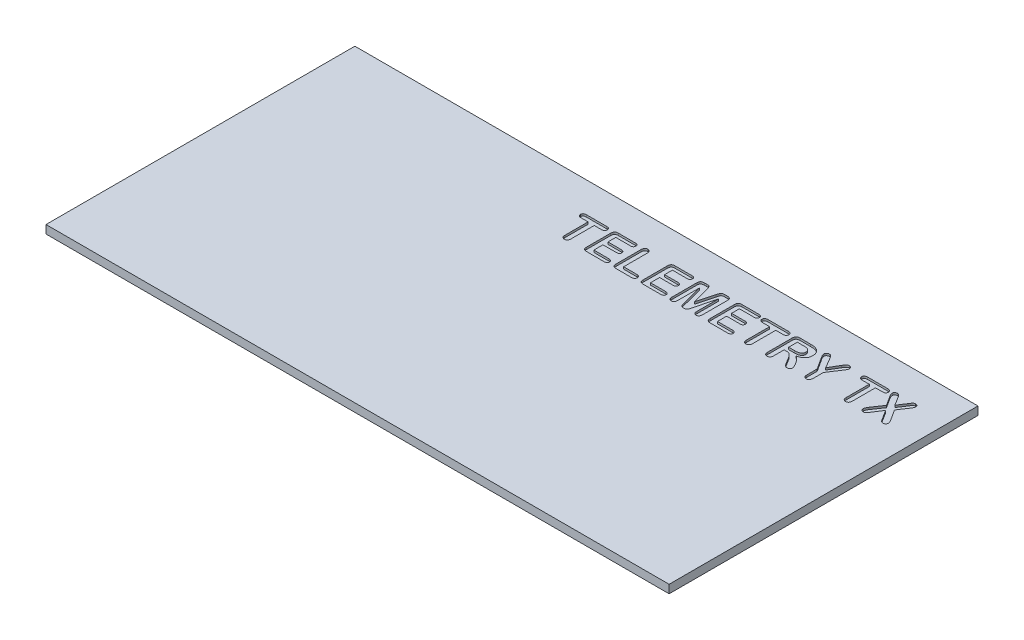
from build123d import *

# Parameters (mm, degrees)
SKETCH1_W           = 150.7
SKETCH1_H           = 74.7
BOSS_EXTRUDE1_DEPTH = 2
CUT_EXTRUDE1_DEPTH  = 0.5


with BuildPart() as part:
    # Sketch1 → Boss-Extrude1 (new body)
    with BuildSketch(Plane(origin=(0, 0, 0), x_dir=(1, 0, 0), z_dir=(0, 1, 0))):
        Rectangle(SKETCH1_W, SKETCH1_H)
    extrude(amount=BOSS_EXTRUDE1_DEPTH)

    # Sketch2 → Cut-Extrude1 (cut)
    # profile 1 of 11: a face of its own
    with BuildSketch(Plane(origin=(0, 2, 0), x_dir=(1, 0, 0), z_dir=(0, 1, 0))):
        with BuildLine():
            Line((62.4328125, 23.884375), (64.15625, 26.4078125))
            Line((64.15625, 26.4078125), (62.70625, 28.659375))
            add(Edge.make_bspline(
                [(62.70625, 28.659375), (62.674291718, 28.711863437), (62.612971243, 28.812576483), (62.528319317, 28.958293651), (62.457920035, 29.093522992), (62.397925139, 29.217591875), (62.354171528, 29.336643603), (62.320110418, 29.450542498), (62.300705678, 29.562873745), (62.298140505, 29.636911591), (62.296875, 29.6734375)],
                knots=[0, 0, 0, 0, 1.331670414, 2.555164369, 3.650619108, 4.635170215, 5.538697084, 6.395999096, 7.20868049, 8, 8, 8, 8], degree=3))
            add(Edge.make_bspline(
                [(62.296875, 29.6734375), (62.299255859, 29.709717184), (62.304043831, 29.782676618), (62.344369849, 29.887563571), (62.406673864, 29.986545995), (62.493008175, 30.075673841), (62.595350729, 30.15271172), (62.711968289, 30.210935045), (62.840389761, 30.243924012), (62.929503853, 30.247946412), (62.975, 30.25)],
                knots=[0, 0, 0, 0, 0.88371339, 1.777171737, 2.709025234, 3.725927513, 4.789507843, 5.82502123, 6.889590265, 8, 8, 8, 8], degree=3))
            add(Edge.make_bspline(
                [(62.975, 30.25), (63.026259004, 30.247681497), (63.124430739, 30.243241078), (63.263206316, 30.207340641), (63.383885276, 30.145194115), (63.489687051, 30.05346807), (63.591515437, 29.928843965), (63.706024038, 29.768175786), (63.84087511, 29.568134374), (63.932893562, 29.41861339), (63.9828125, 29.3375)],
                knots=[0, 0, 0, 0, 0.856633498, 1.640632697, 2.377108086, 3.106645696, 3.965624018, 5.063496707, 6.406981199, 8, 8, 8, 8], degree=3))
            Line((63.9828125, 29.3375), (65.1390625, 27.45))
            Line((65.1390625, 27.45), (66.3734375, 29.3375))
            add(Edge.make_bspline(
                [(66.3734375, 29.3375), (66.421110003, 29.411286135), (66.508542286, 29.546611322), (66.626273301, 29.737259468), (66.731553929, 29.895517955), (66.834410195, 30.024700096), (66.941048032, 30.127670801), (67.063451732, 30.199063945), (67.201712911, 30.243117297), (67.300172503, 30.247639619), (67.3515625, 30.25)],
                knots=[0, 0, 0, 0, 1.496623949, 2.744837013, 3.817943476, 4.732634022, 5.555221563, 6.326834216, 7.126707895, 8, 8, 8, 8], degree=3))
            add(Edge.make_bspline(
                [(67.3515625, 30.25), (67.398633776, 30.248053962), (67.489338031, 30.244304033), (67.618819131, 30.211121497), (67.733984838, 30.153476409), (67.832675339, 30.074933491), (67.916088277, 29.984625782), (67.97503318, 29.88138503), (68.013545353, 29.770403431), (68.017002402, 29.692504333), (68.01875, 29.653125)],
                knots=[0, 0, 0, 0, 1.132100252, 2.181506828, 3.191039156, 4.209567341, 5.204189317, 6.131291943, 7.055335938, 8, 8, 8, 8], degree=3))
            add(Edge.make_bspline(
                [(68.01875, 29.653125), (68.017401098, 29.622316647), (68.014544465, 29.557072374), (67.994499233, 29.456077471), (67.963232862, 29.347094124), (67.916019714, 29.23174796), (67.860785273, 29.106122723), (67.789493596, 28.974620949), (67.708029625, 28.833884538), (67.646320196, 28.739804142), (67.6140625, 28.690625)],
                knots=[0, 0, 0, 0, 0.699379586, 1.481108469, 2.330742825, 3.27072707, 4.308249908, 5.445709565, 6.664782263, 8, 8, 8, 8], degree=3))
            Line((67.6140625, 28.690625), (66.0953125, 26.4078125))
            Line((66.0953125, 26.4078125), (67.7296875, 23.884375))
            add(Edge.make_bspline(
                [(67.7296875, 23.884375), (67.764436344, 23.831487411), (67.830235215, 23.731341816), (67.917495818, 23.586279323), (67.990363374, 23.455680869), (68.049385912, 23.337801278), (68.09472621, 23.227856179), (68.126425867, 23.122226004), (68.146042385, 23.019481872), (68.148707783, 22.95164038), (68.15, 22.91875)],
                knots=[0, 0, 0, 0, 1.42267206, 2.693908744, 3.805137528, 4.784457108, 5.656448903, 6.47523723, 7.260776463, 8, 8, 8, 8], degree=3))
            add(Edge.make_bspline(
                [(68.15, 22.91875), (68.14857157, 22.88848563), (68.145769651, 22.829120903), (68.130322624, 22.741582905), (68.101839934, 22.658606527), (68.062508113, 22.580646776), (68.014433749, 22.507513416), (67.953602736, 22.444199175), (67.886757248, 22.384577608), (67.808199307, 22.33747742), (67.724070934, 22.298102692), (67.634387254, 22.269437693), (67.539057889, 22.254189801), (67.474008142, 22.251420955), (67.440625, 22.25)],
                knots=[0, 0, 0, 0, 1.000825385, 1.963157486, 2.926720584, 3.889052685, 4.843965475, 5.806297575, 6.782844197, 7.795590722, 8.81997505, 9.848977645, 10.89610818, 12, 12, 12, 12], degree=3))
            add(Edge.make_bspline(
                [(67.440625, 22.25), (67.405123478, 22.251191804), (67.336804147, 22.253485317), (67.238704116, 22.271246166), (67.148182733, 22.298684468), (67.042201574, 22.35303627), (66.926137837, 22.439460245), (66.831267765, 22.55315699), (66.75489531, 22.666805023), (66.679974261, 22.785768081), (66.579520052, 22.934101692), (66.50807141, 23.045140394), (66.46875, 23.10625)],
                knots=[0, 0, 0, 0, 0.778086853, 1.497354761, 2.180142313, 2.844233073, 4.100730988, 5.323601136, 6.071330611, 7.104249183, 8.406337728, 10, 10, 10, 10], degree=3))
            Line((66.46875, 23.10625), (65.1125, 25.25))
            Line((65.1125, 25.25), (63.6734375, 23.0421875))
            add(Edge.make_bspline(
                [(63.6734375, 23.0421875), (63.647278334, 23.001638882), (63.599031251, 22.92685238), (63.534496189, 22.823199594), (63.479014295, 22.741596753), (63.42548201, 22.655813472), (63.355131311, 22.565823507), (63.266400374, 22.462098723), (63.156018707, 22.371886426), (63.025722217, 22.302014887), (62.873272714, 22.256139253), (62.763896345, 22.252118906), (62.70625, 22.25)],
                knots=[0, 0, 0, 0, 1.094934508, 2.019460233, 2.770064858, 3.3338705, 4.312410748, 5.358619171, 6.425449731, 7.525220658, 8.695678178, 10, 10, 10, 10], degree=3))
            add(Edge.make_bspline(
                [(62.70625, 22.25), (62.660705497, 22.251896071), (62.572506116, 22.255567915), (62.447054887, 22.2898045), (62.332803625, 22.343541325), (62.232787717, 22.420278154), (62.149124368, 22.518453379), (62.091926177, 22.639221738), (62.054315263, 22.777964521), (62.051489207, 22.877327564), (62.05, 22.9296875)],
                knots=[0, 0, 0, 0, 1.022127674, 1.979405277, 2.901287438, 3.845220278, 4.792850708, 5.772222242, 6.8260595, 8, 8, 8, 8], degree=3))
            add(Edge.make_bspline(
                [(62.05, 22.9296875), (62.051427327, 22.963078404), (62.054387913, 23.032338345), (62.072130398, 23.138716415), (62.102565129, 23.250445277), (62.144830832, 23.367521135), (62.200274472, 23.489142879), (62.266252733, 23.616540623), (62.344748436, 23.749043805), (62.402788052, 23.838235358), (62.4328125, 23.884375)],
                knots=[0, 0, 0, 0, 0.768817885, 1.594694242, 2.475893687, 3.431591364, 4.45659618, 5.550524954, 6.732863178, 8, 8, 8, 8], degree=3))
        make_face()
    # profile 2 of 11: a face of its own
    with BuildSketch(Plane(origin=(0, 2, 0), x_dir=(1, 0, 0), z_dir=(0, 1, 0))):
        with BuildLine():
            Line((60.8578125, 28.75), (59.15, 28.75))
            Line((59.15, 28.75), (59.15, 23.19375))
            add(Edge.make_bspline(
                [(59.15, 23.19375), (59.148148683, 23.118535681), (59.144686184, 22.97786313), (59.105288163, 22.781404942), (59.041477772, 22.614492132), (58.948549707, 22.479737946), (58.835904267, 22.375968674), (58.705825861, 22.302721538), (58.56031622, 22.256840006), (58.457641248, 22.252327359), (58.4046875, 22.25)],
                knots=[0, 0, 0, 0, 1.324771526, 2.4777063, 3.516495944, 4.454151167, 5.338361256, 6.19400724, 7.068574513, 8, 8, 8, 8], degree=3))
            add(Edge.make_bspline(
                [(58.4046875, 22.25), (58.351142683, 22.252124623), (58.24715597, 22.256250747), (58.100563979, 22.305181765), (57.966914435, 22.376697952), (57.853295254, 22.483117179), (57.758625993, 22.617658023), (57.696912448, 22.785554926), (57.654827435, 22.97968454), (57.651673905, 23.119523156), (57.65, 23.19375)],
                knots=[0, 0, 0, 0, 0.936591527, 1.818907611, 2.686883908, 3.580272073, 4.52668274, 5.549195867, 6.699104295, 8, 8, 8, 8], degree=3))
            Line((57.65, 23.19375), (57.65, 28.75))
            Line((57.65, 28.75), (55.940625, 28.75))
            add(Edge.make_bspline(
                [(55.940625, 28.75), (55.877905618, 28.751556279), (55.760231213, 28.754476178), (55.596906818, 28.789852284), (55.456740423, 28.842988626), (55.343325711, 28.922921396), (55.256539538, 29.021221203), (55.19315205, 29.133869266), (55.157079634, 29.261375609), (55.152406376, 29.350818595), (55.15, 29.396875)],
                knots=[0, 0, 0, 0, 1.298175259, 2.435642608, 3.448405227, 4.386245553, 5.281324188, 6.14672195, 7.045701294, 8, 8, 8, 8], degree=3))
            add(Edge.make_bspline(
                [(55.15, 29.396875), (55.152003331, 29.445113421), (55.155866362, 29.538131793), (55.19667311, 29.668486726), (55.260181417, 29.783764012), (55.351502619, 29.879883878), (55.466220724, 29.95798555), (55.605087679, 30.011772948), (55.765644078, 30.044805548), (55.880029663, 30.048201178), (55.940625, 30.05)],
                knots=[0, 0, 0, 0, 0.993926626, 1.916593339, 2.793690024, 3.692250099, 4.629614642, 5.63892321, 6.749228366, 8, 8, 8, 8], degree=3))
            Line((55.940625, 30.05), (60.8578125, 30.05))
            add(Edge.make_bspline(
                [(60.8578125, 30.05), (60.921559191, 30.048386745), (61.04126913, 30.045357212), (61.207509792, 30.01065929), (61.349519021, 29.955899164), (61.462318061, 29.873323553), (61.552113655, 29.77610947), (61.613727111, 29.661365636), (61.653058231, 29.533799084), (61.657222549, 29.443532148), (61.659375, 29.396875)],
                knots=[0, 0, 0, 0, 1.304496451, 2.449714448, 3.464685333, 4.39788137, 5.28974218, 6.154486031, 7.046091257, 8, 8, 8, 8], degree=3))
            add(Edge.make_bspline(
                [(61.659375, 29.396875), (61.657109889, 29.350784207), (61.652703748, 29.261127431), (61.614520318, 29.133710702), (61.549633141, 29.021124348), (61.461248062, 28.922855601), (61.346290994, 28.842994176), (61.204147791, 28.789615927), (61.039182525, 28.754757885), (60.920516423, 28.751644914), (60.8578125, 28.75)],
                knots=[0, 0, 0, 0, 0.94771637, 1.843517728, 2.708217129, 3.604275273, 4.544436114, 5.560171289, 6.710778986, 8, 8, 8, 8], degree=3))
        make_face()
    # profile 3 of 11: a face of its own
    with BuildSketch(Plane(origin=(0, 2, 0), x_dir=(1, 0, 0), z_dir=(0, 1, 0))):
        with BuildLine():
            Line((48.15, 23.2046875), (48.15, 25.659375))
            Line((48.15, 25.659375), (46.2609375, 28.5875))
            add(Edge.make_bspline(
                [(46.2609375, 28.5875), (46.222833372, 28.649946443), (46.151649635, 28.766604965), (46.053280373, 28.930600113), (45.975574037, 29.074468671), (45.912489161, 29.198248655), (45.865004183, 29.307990618), (45.834532149, 29.408875621), (45.811389342, 29.501566338), (45.808967973, 29.561855242), (45.8078125, 29.590625)],
                knots=[0, 0, 0, 0, 1.578704085, 2.94923576, 4.126117189, 5.106279063, 5.947518741, 6.701154241, 7.3801931, 8, 8, 8, 8], degree=3))
            add(Edge.make_bspline(
                [(45.8078125, 29.590625), (45.80996706, 29.634178898), (45.814213448, 29.720018557), (45.85595359, 29.843692969), (45.922435739, 29.957438135), (46.013983872, 30.058508559), (46.123201055, 30.144281846), (46.248850094, 30.205885586), (46.386437584, 30.243070011), (46.482054922, 30.247645773), (46.53125, 30.25)],
                knots=[0, 0, 0, 0, 0.958325345, 1.888747574, 2.846728284, 3.847924353, 4.880105609, 5.892649082, 6.915768894, 8, 8, 8, 8], degree=3))
            add(Edge.make_bspline(
                [(46.53125, 30.25), (46.581483277, 30.248291181), (46.677032858, 30.245040806), (46.811177221, 30.210032829), (46.927239864, 30.152324779), (47.006356289, 30.080557509), (47.064033949, 30.010725877), (47.113749633, 29.947289082), (47.168019192, 29.871578987), (47.229344787, 29.786610322), (47.293181459, 29.688321885), (47.363385604, 29.579730202), (47.438534825, 29.458648233), (47.490164635, 29.373994811), (47.5171875, 29.3296875)],
                knots=[0, 0, 0, 0, 1.265501549, 2.407132258, 3.471422434, 4.505396917, 5.074392452, 5.758183804, 6.539210356, 7.425661256, 8.402912227, 9.49699419, 10.68993536, 12, 12, 12, 12], degree=3))
            Line((47.5171875, 29.3296875), (48.928125, 26.95))
            Line((48.928125, 26.95), (50.35625, 29.3296875))
            add(Edge.make_bspline(
                [(50.35625, 29.3296875), (50.396912009, 29.397373632), (50.47078452, 29.520342089), (50.573827592, 29.693031251), (50.669699951, 29.844263251), (50.770501024, 29.980292855), (50.884080481, 30.096404558), (51.014016573, 30.1861902), (51.167514131, 30.242632806), (51.278645238, 30.247449232), (51.3375, 30.25)],
                knots=[0, 0, 0, 0, 1.334293152, 2.4240707, 3.398137561, 4.359235497, 5.280289657, 6.12976972, 7.009530634, 8, 8, 8, 8], degree=3))
            add(Edge.make_bspline(
                [(51.3375, 30.25), (51.385147839, 30.247690637), (51.477216734, 30.243228303), (51.609203241, 30.205862054), (51.728281211, 30.144066601), (51.831592809, 30.059060871), (51.919387598, 29.961494951), (51.980791488, 29.851128427), (52.021556328, 29.73406268), (52.025911656, 29.652425088), (52.028125, 29.6109375)],
                knots=[0, 0, 0, 0, 1.094596951, 2.115066153, 3.127980142, 4.159086809, 5.178077631, 6.127785484, 7.048555174, 8, 8, 8, 8], degree=3))
            add(Edge.make_bspline(
                [(52.028125, 29.6109375), (52.026947726, 29.576472008), (52.024593583, 29.50755285), (52.004473463, 29.404338205), (51.973345606, 29.301088132), (51.927554279, 29.194614059), (51.865026931, 29.079598518), (51.788287119, 28.946838433), (51.694861624, 28.793608536), (51.623836825, 28.686722584), (51.5859375, 28.6296875)],
                knots=[0, 0, 0, 0, 0.756990066, 1.51372037, 2.303254715, 3.124043972, 4.056098571, 5.17933979, 6.494876167, 8, 8, 8, 8], degree=3))
            Line((51.5859375, 28.6296875), (49.65, 25.659375))
            Line((49.65, 25.659375), (49.65, 23.2046875))
            add(Edge.make_bspline(
                [(49.65, 23.2046875), (49.648304493, 23.129441433), (49.645119512, 22.988093043), (49.603525312, 22.791434391), (49.539544913, 22.622511802), (49.444327352, 22.485758021), (49.327942504, 22.382095587), (49.198663395, 22.303069726), (49.051658538, 22.259401159), (48.949221688, 22.253179405), (48.896875, 22.25)],
                knots=[0, 0, 0, 0, 1.313945559, 2.46822319, 3.498523897, 4.453875132, 5.350468488, 6.208266576, 7.084398721, 8, 8, 8, 8], degree=3))
            add(Edge.make_bspline(
                [(48.896875, 22.25), (48.843887765, 22.252224253), (48.740493554, 22.256564448), (48.594858781, 22.304331488), (48.463448526, 22.377829783), (48.349974758, 22.482542857), (48.256689869, 22.618987002), (48.194969352, 22.788553476), (48.155323027, 22.986708061), (48.151849682, 23.128942499), (48.15, 23.2046875)],
                knots=[0, 0, 0, 0, 0.923985227, 1.802976204, 2.651787258, 3.541808588, 4.479486535, 5.515122343, 6.676712466, 8, 8, 8, 8], degree=3))
        make_face()
    # profile 4 of 11: a face of its own
    with BuildSketch(Plane(origin=(0, 2, 0), x_dir=(1, 0, 0), z_dir=(0, 1, 0))):
        with BuildLine():
            Line((40.690625, 25.65), (40.15, 25.65))
            Line((40.15, 25.65), (40.15, 23.19375))
            add(Edge.make_bspline(
                [(40.15, 23.19375), (40.148096592, 23.118036714), (40.14453521, 22.976372994), (40.10592185, 22.779087942), (40.040939828, 22.612697985), (39.949114691, 22.478089841), (39.835320699, 22.376111968), (39.705495892, 22.302279275), (39.559177287, 22.257079403), (39.456053039, 22.252401111), (39.403125, 22.25)],
                knots=[0, 0, 0, 0, 1.331902197, 2.492062242, 3.520752585, 4.456973203, 5.333663409, 6.188000262, 7.069999586, 8, 8, 8, 8], degree=3))
            add(Edge.make_bspline(
                [(39.403125, 22.25), (39.346559233, 22.252870585), (39.237692418, 22.258395331), (39.084378435, 22.304237005), (38.951971433, 22.381842038), (38.840161652, 22.488642128), (38.753397426, 22.626684386), (38.693640626, 22.792943163), (38.655875984, 22.985821506), (38.652035548, 23.123762216), (38.65, 23.196875)],
                knots=[0, 0, 0, 0, 0.98783513, 1.901193439, 2.76656523, 3.649069121, 4.578809423, 5.590416226, 6.722847106, 8, 8, 8, 8], degree=3))
            Line((38.65, 23.196875), (38.65, 29.0984375))
            add(Edge.make_bspline(
                [(38.65, 29.0984375), (38.65228991, 29.176267709), (38.656586623, 29.322305742), (38.698247097, 29.524345325), (38.765988857, 29.694003921), (38.86617733, 29.830484722), (39.0010289, 29.932347818), (39.168532889, 30.0019088), (39.368832048, 30.043457737), (39.513320254, 30.047719729), (39.590625, 30.05)],
                knots=[0, 0, 0, 0, 1.204539147, 2.260157444, 3.178834964, 4.014831347, 4.849268471, 5.763683293, 6.803515522, 8, 8, 8, 8], degree=3))
            Line((39.590625, 30.05), (42.084375, 30.05))
            add(Edge.make_bspline(
                [(42.084375, 30.05), (42.16718904, 30.049241289), (42.326605219, 30.047780777), (42.55701692, 30.041122713), (42.768508135, 30.024866614), (42.963554693, 30.00497796), (43.144721841, 29.978334009), (43.314561151, 29.936352071), (43.476378601, 29.886469062), (43.577994813, 29.841121333), (43.628125, 29.81875)],
                knots=[0, 0, 0, 0, 1.26312999, 2.431512321, 3.514756431, 4.497259456, 5.421894158, 6.30431173, 7.16346842, 8, 8, 8, 8], degree=3))
            add(Edge.make_bspline(
                [(43.628125, 29.81875), (43.688110007, 29.791823841), (43.807384229, 29.738283852), (43.97561674, 29.636538884), (44.13360203, 29.519869576), (44.278765557, 29.386055946), (44.412232078, 29.240678272), (44.525981306, 29.079440216), (44.625315873, 28.908884291), (44.706502129, 28.726957248), (44.769751509, 28.536772717), (44.817914802, 28.340545389), (44.844130303, 28.138215137), (44.848033408, 28.001630894), (44.85, 27.9328125)],
                knots=[0, 0, 0, 0, 0.991101386, 1.970706541, 2.959125982, 3.949043219, 4.94477413, 5.930285116, 6.919453739, 7.918248778, 8.929482208, 9.939493973, 10.961807665, 12, 12, 12, 12], degree=3))
            add(Edge.make_bspline(
                [(44.85, 27.9328125), (44.848608958, 27.862947365), (44.845891299, 27.72645288), (44.821524154, 27.527432164), (44.784414518, 27.338614016), (44.732375496, 27.159935063), (44.660352848, 26.993382569), (44.576792392, 26.8367998), (44.476956322, 26.690959171), (44.361042601, 26.556409395), (44.228651042, 26.432958878), (44.081840548, 26.317863911), (43.91960645, 26.211632575), (43.740235974, 26.116742544), (43.545611974, 26.030214442), (43.334525431, 25.955314046), (43.108946761, 25.884605913), (42.95134595, 25.84936816), (42.8703125, 25.83125)],
                knots=[0, 0, 0, 0, 1.055142993, 2.061417327, 3.024364171, 3.960444909, 4.866579139, 5.760848635, 6.638237999, 7.530982974, 8.438346324, 9.368654669, 10.346405169, 11.363786046, 12.431180916, 13.561267985, 14.746079633, 16, 16, 16, 16], degree=3))
            add(Edge.make_bspline(
                [(42.8703125, 25.83125), (42.940563627, 25.79216374), (43.083809297, 25.71246484), (43.285394024, 25.560309762), (43.484591723, 25.385967451), (43.673614673, 25.183937468), (43.857272114, 24.96853653), (44.034654235, 24.745285024), (44.200085596, 24.514015546), (44.352553084, 24.278296191), (44.493594774, 24.046621457), (44.619104822, 23.823247047), (44.72670385, 23.610679944), (44.818136097, 23.413266465), (44.890966948, 23.237073073), (44.942854867, 23.087946522), (44.97771528, 22.969725921), (44.984615789, 22.899616279), (44.9875, 22.8703125)],
                knots=[0, 0, 0, 0, 1.03513849, 2.110700756, 3.247524223, 4.444168505, 5.672631725, 6.896242247, 8.11841533, 9.33624741, 10.514118669, 11.614189172, 12.638032039, 13.584270828, 14.418327787, 15.09350525, 15.621111712, 16, 16, 16, 16], degree=3))
            add(Edge.make_bspline(
                [(44.9875, 22.8703125), (44.98216706, 22.819526922), (44.970977138, 22.712965308), (44.906121941, 22.590214673), (44.837503828, 22.499137373), (44.775857923, 22.434970428), (44.703391772, 22.381084969), (44.623570439, 22.333725298), (44.535936767, 22.296069948), (44.440729963, 22.270037106), (44.339247305, 22.251658423), (44.268836881, 22.250561317), (44.2328125, 22.25)],
                knots=[0, 0, 0, 0, 1.406975553, 2.952207972, 3.767564478, 4.575194754, 5.410805362, 6.266190622, 7.146975177, 8.048514508, 9.001553276, 10, 10, 10, 10], degree=3))
            add(Edge.make_bspline(
                [(44.2328125, 22.25), (44.190485126, 22.251315718), (44.10877682, 22.253855566), (43.991741207, 22.278598514), (43.883987433, 22.314979582), (43.756309797, 22.388025635), (43.615543649, 22.507570262), (43.496271861, 22.655016491), (43.404281309, 22.794375384), (43.324110257, 22.922491172), (43.229132112, 23.070883733), (43.164308483, 23.178475124), (43.1296875, 23.2359375)],
                knots=[0, 0, 0, 0, 0.811939239, 1.567358733, 2.288822191, 2.987519458, 4.379962622, 5.808282274, 6.615771143, 7.58722562, 8.711386222, 10, 10, 10, 10], degree=3))
            Line((43.1296875, 23.2359375), (42.5015625, 24.26875))
            add(Edge.make_bspline(
                [(42.5015625, 24.26875), (42.448007762, 24.35818697), (42.34673237, 24.52731793), (42.194041277, 24.76110198), (42.048618902, 24.959997123), (41.911932578, 25.128426016), (41.779109582, 25.26892008), (41.646587895, 25.384587508), (41.51089551, 25.474106418), (41.372928428, 25.544403547), (41.22468186, 25.593009798), (41.062279385, 25.627001811), (40.882277676, 25.647128439), (40.756303361, 25.649015931), (40.690625, 25.65)],
                knots=[0, 0, 0, 0, 1.54923933, 2.929709427, 4.148172657, 5.209662816, 6.151357592, 7.018659628, 7.817301611, 8.561575462, 9.313059885, 10.128334294, 11.024182546, 12, 12, 12, 12], degree=3))
        make_face()
        with BuildLine():
            Line((41.575, 28.85), (40.15, 28.85))
            Line((40.15, 28.85), (40.15, 26.75))
            Line((40.15, 26.75), (41.5328125, 26.75))
            add(Edge.make_bspline(
                [(41.5328125, 26.75), (41.621899714, 26.75127689), (41.793478111, 26.753736128), (42.039279629, 26.770141678), (42.263286748, 26.799628735), (42.46476735, 26.840836644), (42.646025907, 26.895426078), (42.802718654, 26.97172563), (42.940663201, 27.060025032), (43.053492411, 27.170076165), (43.144207181, 27.299663417), (43.205634711, 27.452455705), (43.243901555, 27.625728112), (43.247901064, 27.748217654), (43.25, 27.8125)],
                knots=[0, 0, 0, 0, 1.392051732, 2.681035748, 3.846991481, 4.919597892, 5.892539963, 6.795281946, 7.634960986, 8.440706374, 9.24212453, 10.088520951, 10.996858383, 12, 12, 12, 12], degree=3))
            add(Edge.make_bspline(
                [(43.25, 27.8125), (43.248571566, 27.864245705), (43.245773106, 27.965621295), (43.212893031, 28.11176513), (43.162684784, 28.24889335), (43.092019138, 28.374943888), (43.004705882, 28.490348336), (42.898568342, 28.588530748), (42.778462733, 28.674059315), (42.688308193, 28.714995582), (42.6421875, 28.7359375)],
                knots=[0, 0, 0, 0, 1.054557985, 2.06599635, 3.041648879, 4.026871944, 5.005128146, 5.982979788, 6.968145478, 8, 8, 8, 8], degree=3))
            add(Edge.make_bspline(
                [(42.6421875, 28.7359375), (42.616803692, 28.74521542), (42.561625573, 28.765383323), (42.468522357, 28.788464852), (42.359085095, 28.805690213), (42.234253115, 28.823741155), (42.092893521, 28.835819414), (41.93493044, 28.84240535), (41.760480227, 28.849815464), (41.638551374, 28.849936772), (41.575, 28.85)],
                knots=[0, 0, 0, 0, 0.601274756, 1.307022564, 2.130372336, 3.066540635, 4.11402688, 5.286356465, 6.585603249, 8, 8, 8, 8], degree=3))
        make_face(mode=Mode.SUBTRACT)
    # profile 5 of 11: a face of its own
    with BuildSketch(Plane(origin=(0, 2, 0), x_dir=(1, 0, 0), z_dir=(0, 1, 0))):
        with BuildLine():
            Line((36.7578125, 28.75), (35.05, 28.75))
            Line((35.05, 28.75), (35.05, 23.19375))
            add(Edge.make_bspline(
                [(35.05, 23.19375), (35.048148683, 23.118535681), (35.044686184, 22.97786313), (35.005288163, 22.781404942), (34.941477772, 22.614492132), (34.848549707, 22.479737946), (34.735904267, 22.375968674), (34.605825861, 22.302721538), (34.46031622, 22.256840006), (34.357641248, 22.252327359), (34.3046875, 22.25)],
                knots=[0, 0, 0, 0, 1.324771526, 2.4777063, 3.516495944, 4.454151167, 5.338361256, 6.19400724, 7.068574513, 8, 8, 8, 8], degree=3))
            add(Edge.make_bspline(
                [(34.3046875, 22.25), (34.251142683, 22.252124623), (34.14715597, 22.256250747), (34.000563979, 22.305181765), (33.866914435, 22.376697952), (33.753295254, 22.483117179), (33.658625993, 22.617658023), (33.596912448, 22.785554926), (33.554827435, 22.97968454), (33.551673905, 23.119523156), (33.55, 23.19375)],
                knots=[0, 0, 0, 0, 0.936591527, 1.818907611, 2.686883908, 3.580272073, 4.52668274, 5.549195867, 6.699104295, 8, 8, 8, 8], degree=3))
            Line((33.55, 23.19375), (33.55, 28.75))
            Line((33.55, 28.75), (31.840625, 28.75))
            add(Edge.make_bspline(
                [(31.840625, 28.75), (31.777905618, 28.751556279), (31.660231213, 28.754476178), (31.496906818, 28.789852284), (31.356740423, 28.842988626), (31.243325711, 28.922921396), (31.156539538, 29.021221203), (31.09315205, 29.133869266), (31.057079634, 29.261375609), (31.052406376, 29.350818595), (31.05, 29.396875)],
                knots=[0, 0, 0, 0, 1.298175259, 2.435642608, 3.448405227, 4.386245553, 5.281324188, 6.14672195, 7.045701294, 8, 8, 8, 8], degree=3))
            add(Edge.make_bspline(
                [(31.05, 29.396875), (31.052003331, 29.445113421), (31.055866362, 29.538131793), (31.09667311, 29.668486726), (31.160181417, 29.783764012), (31.251502619, 29.879883878), (31.366220724, 29.95798555), (31.505087679, 30.011772948), (31.665644078, 30.044805548), (31.780029663, 30.048201178), (31.840625, 30.05)],
                knots=[0, 0, 0, 0, 0.993926626, 1.916593339, 2.793690024, 3.692250099, 4.629614642, 5.63892321, 6.749228366, 8, 8, 8, 8], degree=3))
            Line((31.840625, 30.05), (36.7578125, 30.05))
            add(Edge.make_bspline(
                [(36.7578125, 30.05), (36.821559191, 30.048386745), (36.94126913, 30.045357212), (37.107509792, 30.01065929), (37.249519021, 29.955899164), (37.362318061, 29.873323553), (37.452113655, 29.77610947), (37.513727111, 29.661365636), (37.553058231, 29.533799084), (37.557222549, 29.443532148), (37.559375, 29.396875)],
                knots=[0, 0, 0, 0, 1.304496451, 2.449714448, 3.464685333, 4.39788137, 5.28974218, 6.154486031, 7.046091257, 8, 8, 8, 8], degree=3))
            add(Edge.make_bspline(
                [(37.559375, 29.396875), (37.557109889, 29.350784207), (37.552703748, 29.261127431), (37.514520318, 29.133710702), (37.449633141, 29.021124348), (37.361248062, 28.922855601), (37.246290994, 28.842994176), (37.104147791, 28.789615927), (36.939182525, 28.754757885), (36.820516423, 28.751644914), (36.7578125, 28.75)],
                knots=[0, 0, 0, 0, 0.94771637, 1.843517728, 2.708217129, 3.604275273, 4.544436114, 5.560171289, 6.710778986, 8, 8, 8, 8], degree=3))
        make_face()
    # profile 6 of 11: a face of its own
    with BuildSketch(Plane(origin=(0, 2, 0), x_dir=(1, 0, 0), z_dir=(0, 1, 0))):
        with BuildLine():
            Line((29.678125, 28.85), (26.15, 28.85))
            Line((26.15, 28.85), (26.15, 26.95))
            Line((26.15, 26.95), (29.3984375, 26.95))
            add(Edge.make_bspline(
                [(29.3984375, 26.95), (29.454808283, 26.947866606), (29.560619514, 26.943862103), (29.708735191, 26.915536651), (29.833999736, 26.863546668), (29.935907692, 26.790996382), (30.014173465, 26.700761291), (30.071706533, 26.597893551), (30.105341496, 26.480165366), (30.109023021, 26.397615403), (30.1109375, 26.3546875)],
                knots=[0, 0, 0, 0, 1.285293232, 2.412569968, 3.418386025, 4.354403319, 5.23810445, 6.120527863, 7.022630715, 8, 8, 8, 8], degree=3))
            add(Edge.make_bspline(
                [(30.1109375, 26.3546875), (30.109076808, 26.311733294), (30.105498714, 26.22913275), (30.071079409, 26.111555816), (30.015670117, 26.006526708), (29.938153342, 25.914393747), (29.837089175, 25.839168055), (29.711507056, 25.785881982), (29.562348096, 25.755721734), (29.455353341, 25.751986798), (29.3984375, 25.75)],
                knots=[0, 0, 0, 0, 0.971200242, 1.867609123, 2.749214551, 3.645234956, 4.57279535, 5.576919765, 6.711042891, 8, 8, 8, 8], degree=3))
            Line((29.3984375, 25.75), (26.15, 25.75))
            Line((26.15, 25.75), (26.15, 23.55))
            Line((26.15, 23.55), (29.8, 23.55))
            add(Edge.make_bspline(
                [(29.8, 23.55), (29.857921056, 23.547832714), (29.966806448, 23.543758448), (30.120281315, 23.515623535), (30.250341207, 23.4621797), (30.357739329, 23.389015476), (30.442612592, 23.299215593), (30.500991963, 23.192434212), (30.53891324, 23.073371804), (30.542105854, 22.988843341), (30.54375, 22.9453125)],
                knots=[0, 0, 0, 0, 1.281412047, 2.408917619, 3.431661904, 4.368016538, 5.264760761, 6.136510243, 7.040331808, 8, 8, 8, 8], degree=3))
            add(Edge.make_bspline(
                [(30.54375, 22.9453125), (30.542191646, 22.90278967), (30.539184528, 22.820734408), (30.50030769, 22.705092373), (30.442190584, 22.60050829), (30.357722269, 22.511097277), (30.250702936, 22.437376187), (30.11967536, 22.386877569), (29.967095907, 22.35549324), (29.857985531, 22.351906261), (29.8, 22.35)],
                knots=[0, 0, 0, 0, 0.944744106, 1.823049547, 2.692159438, 3.596595969, 4.540982691, 5.5681055, 6.707595947, 8, 8, 8, 8], degree=3))
            Line((29.8, 22.35), (25.56875, 22.35))
            add(Edge.make_bspline(
                [(25.56875, 22.35), (25.492475037, 22.352219706), (25.350535707, 22.356350336), (25.153879542, 22.398310057), (24.98996276, 22.467712994), (24.85747362, 22.569815024), (24.761692234, 22.708460997), (24.694820923, 22.878233228), (24.657526723, 23.081749071), (24.652624476, 23.227969299), (24.65, 23.30625)],
                knots=[0, 0, 0, 0, 1.189456171, 2.21344733, 3.119993849, 3.948013107, 4.78741338, 5.71757596, 6.778077714, 8, 8, 8, 8], degree=3))
            Line((24.65, 23.30625), (24.65, 29.09375))
            add(Edge.make_bspline(
                [(24.65, 29.09375), (24.651201262, 29.147445357), (24.653482324, 29.249406838), (24.670448113, 29.394954422), (24.699314995, 29.525262549), (24.741782749, 29.640932339), (24.796000542, 29.742745589), (24.866313479, 29.828913881), (24.950345927, 29.899741117), (25.047397964, 29.957205241), (25.158881578, 29.998291889), (25.282794666, 30.030258142), (25.42146653, 30.046211421), (25.51819793, 30.048699647), (25.56875, 30.05)],
                knots=[0, 0, 0, 0, 1.257097402, 2.387087425, 3.425508426, 4.374733264, 5.264346199, 6.113849079, 6.961774747, 7.825601221, 8.740599092, 9.73444991, 10.816017894, 12, 12, 12, 12], degree=3))
            Line((25.56875, 30.05), (29.678125, 30.05))
            add(Edge.make_bspline(
                [(29.678125, 30.05), (29.736547132, 30.047786723), (29.846428114, 30.043623967), (30.00070829, 30.016198256), (30.129929303, 29.962007982), (30.236282782, 29.889626428), (30.316268309, 29.798524894), (30.377029837, 29.695816642), (30.4115646, 29.57819476), (30.415281148, 29.495527854), (30.4171875, 29.453125)],
                knots=[0, 0, 0, 0, 1.304353081, 2.453241492, 3.474309848, 4.409392115, 5.298405909, 6.157667996, 7.055001114, 8, 8, 8, 8], degree=3))
            add(Edge.make_bspline(
                [(30.4171875, 29.453125), (30.415355602, 29.409658237), (30.41180473, 29.325404151), (30.376561889, 29.205598616), (30.317302813, 29.100325512), (30.236117896, 29.008990145), (30.130317299, 28.936073028), (30.000273997, 28.88431663), (29.846500227, 28.856208719), (29.736572164, 28.852155198), (29.678125, 28.85)],
                knots=[0, 0, 0, 0, 0.962139494, 1.864969442, 2.738963821, 3.622448103, 4.551714319, 5.562017248, 6.70375977, 8, 8, 8, 8], degree=3))
        make_face()
    # profile 7 of 11: a face of its own
    with BuildSketch(Plane(origin=(0, 2, 0), x_dir=(1, 0, 0), z_dir=(0, 1, 0))):
        with BuildLine():
            Line((18.1953125, 23.5421875), (16.95, 28.45))
            Line((16.95, 28.45), (16.95, 23.1328125))
            add(Edge.make_bspline(
                [(16.95, 23.1328125), (16.947907461, 23.063333157), (16.943988479, 22.933209728), (16.907400534, 22.751394285), (16.850372692, 22.595141769), (16.763380628, 22.468460354), (16.657659951, 22.370395647), (16.535251192, 22.298900329), (16.395807658, 22.257726874), (16.297668864, 22.25263527), (16.246875, 22.25)],
                knots=[0, 0, 0, 0, 1.30362474, 2.441475632, 3.469867302, 4.406120522, 5.299256138, 6.158467928, 7.046875082, 8, 8, 8, 8], degree=3))
            add(Edge.make_bspline(
                [(16.246875, 22.25), (16.197608069, 22.252604531), (16.101965794, 22.257660727), (15.965916331, 22.299893329), (15.844037221, 22.368603424), (15.73755648, 22.465360857), (15.65246583, 22.591724363), (15.59112593, 22.745944899), (15.55650159, 22.928170653), (15.552257344, 23.058701095), (15.55, 23.128125)],
                knots=[0, 0, 0, 0, 0.931401934, 1.808137819, 2.66942439, 3.563139973, 4.50699297, 5.529036112, 6.685793447, 8, 8, 8, 8], degree=3))
            Line((15.55, 23.128125), (15.55, 29.196875))
            add(Edge.make_bspline(
                [(15.55, 29.196875), (15.55114005, 29.236995247), (15.553335612, 29.314260666), (15.563266323, 29.425270323), (15.583481475, 29.526462509), (15.612876389, 29.616483907), (15.649637105, 29.696656274), (15.692623822, 29.76782995), (15.746416551, 29.827888816), (15.830577072, 29.893492286), (15.953440969, 29.957265406), (16.120149246, 30.011979855), (16.309169936, 30.044473785), (16.442576515, 30.048099582), (16.5125, 30.05)],
                knots=[0, 0, 0, 0, 0.969665939, 1.867427353, 2.689218696, 3.457225703, 4.149776576, 4.816702983, 5.458338976, 6.085245707, 7.385799533, 8.77853966, 10.311509556, 12, 12, 12, 12], degree=3))
            Line((16.5125, 30.05), (16.9921875, 30.05))
            add(Edge.make_bspline(
                [(16.9921875, 30.05), (17.059389337, 30.049169595), (17.184071006, 30.04762892), (17.35615536, 30.035053086), (17.498484939, 30.010373274), (17.615263242, 29.977272365), (17.710807245, 29.927727937), (17.791822327, 29.865022203), (17.858577528, 29.78463095), (17.91276032, 29.685868381), (17.961107117, 29.563891848), (18.011565151, 29.413741229), (18.068449476, 29.23288721), (18.103206169, 29.100692908), (18.121875, 29.0296875)],
                knots=[0, 0, 0, 0, 1.38803647, 2.575267475, 3.558583177, 4.368440808, 5.070869684, 5.768090105, 6.470518981, 7.212366556, 8.085347214, 9.177334938, 10.483864409, 12, 12, 12, 12], degree=3))
            Line((18.121875, 29.0296875), (19.25, 24.85))
            Line((19.25, 24.85), (20.3640625, 29.0296875))
            add(Edge.make_bspline(
                [(20.3640625, 29.0296875), (20.382738478, 29.100688781), (20.417508475, 29.232875398), (20.474308193, 29.413778284), (20.525011745, 29.5637871), (20.572773837, 29.686398275), (20.629162193, 29.784193697), (20.695570693, 29.865089062), (20.776728003, 29.927688241), (20.872644287, 29.977602983), (20.990640093, 30.0102646), (21.134467693, 30.035065934), (21.307602358, 30.047578365), (21.432799892, 30.049154178), (21.5, 30.05)],
                knots=[0, 0, 0, 0, 1.511478991, 2.813995637, 3.902629473, 4.772928891, 5.517843496, 6.218114959, 6.913193965, 7.613465427, 8.431097637, 9.421953472, 10.616226692, 12, 12, 12, 12], degree=3))
            Line((21.5, 30.05), (21.98125, 30.05))
            add(Edge.make_bspline(
                [(21.98125, 30.05), (22.051686788, 30.048080923), (22.18611359, 30.044418415), (22.376269802, 30.0122222), (22.543356384, 29.957185682), (22.666502632, 29.89366973), (22.750389906, 29.827375468), (22.806090128, 29.768476081), (22.848234671, 29.69613206), (22.888115761, 29.617279501), (22.913793128, 29.525839046), (22.937541737, 29.425582316), (22.946432949, 29.314202701), (22.948780848, 29.236975435), (22.95, 29.196875)],
                knots=[0, 0, 0, 0, 1.69575107, 3.236297379, 4.624693315, 5.921190494, 6.546141798, 7.194208304, 7.859054455, 8.55478081, 9.316580419, 10.138397467, 11.033358612, 12, 12, 12, 12], degree=3))
            Line((22.95, 29.196875), (22.95, 23.128125))
            add(Edge.make_bspline(
                [(22.95, 23.128125), (22.947847857, 23.059181971), (22.943803066, 22.929608753), (22.907767595, 22.748626462), (22.849867125, 22.593315188), (22.763901854, 22.466888694), (22.65686996, 22.369996049), (22.533633775, 22.298873522), (22.392648802, 22.257736754), (22.293497303, 22.252638362), (22.2421875, 22.25)],
                knots=[0, 0, 0, 0, 1.293518314, 2.431070022, 3.450077594, 4.386084638, 5.272371044, 6.139835868, 7.037385671, 8, 8, 8, 8], degree=3))
            add(Edge.make_bspline(
                [(22.2421875, 22.25), (22.193457823, 22.252639653), (22.098868326, 22.257763499), (21.963815075, 22.299590291), (21.843702905, 22.37085154), (21.738041178, 22.468377484), (21.651542663, 22.595490939), (21.59209138, 22.750989216), (21.556177749, 22.933276002), (21.552150401, 23.063356227), (21.55, 23.1328125)],
                knots=[0, 0, 0, 0, 0.922456205, 1.790585791, 2.649061979, 3.550299627, 4.495046019, 5.536376652, 6.684549498, 8, 8, 8, 8], degree=3))
            Line((21.55, 23.1328125), (21.55, 28.45))
            Line((21.55, 28.45), (20.3046875, 23.5421875))
            add(Edge.make_bspline(
                [(20.3046875, 23.5421875), (20.285728816, 23.467627208), (20.250514537, 23.329137267), (20.197171135, 23.138144268), (20.149819082, 22.978934434), (20.110276683, 22.844677538), (20.061350412, 22.729200643), (19.998694534, 22.623293325), (19.916520003, 22.525065836), (19.823913392, 22.429085576), (19.709851688, 22.347455742), (19.574141279, 22.289638604), (19.418385844, 22.255036903), (19.308002836, 22.251735031), (19.25, 22.25)],
                knots=[0, 0, 0, 0, 1.501096557, 2.788170037, 3.868651286, 4.742863802, 5.516817816, 6.309819568, 7.133547599, 8.010237478, 8.906902995, 9.849006967, 10.869720086, 12, 12, 12, 12], degree=3))
            add(Edge.make_bspline(
                [(19.25, 22.25), (19.205627891, 22.251491551), (19.119958556, 22.254371293), (18.997043177, 22.276649187), (18.883994505, 22.312278751), (18.782252778, 22.364409747), (18.691830339, 22.428325977), (18.61303992, 22.502130934), (18.541686246, 22.580644681), (18.464762214, 22.700670755), (18.386361558, 22.865614689), (18.316886607, 23.080790691), (18.259562583, 23.309178095), (18.216976016, 23.463622575), (18.1953125, 23.5421875)],
                knots=[0, 0, 0, 0, 0.868933015, 1.67765103, 2.439282522, 3.183205666, 3.908055228, 4.601401517, 5.295498424, 5.980457608, 7.386244959, 8.861049734, 10.403235965, 12, 12, 12, 12], degree=3))
        make_face()
    # profile 8 of 11: a face of its own
    with BuildSketch(Plane(origin=(0, 2, 0), x_dir=(1, 0, 0), z_dir=(0, 1, 0))):
        with BuildLine():
            Line((13.478125, 28.85), (9.95, 28.85))
            Line((9.95, 28.85), (9.95, 26.95))
            Line((9.95, 26.95), (13.1984375, 26.95))
            add(Edge.make_bspline(
                [(13.1984375, 26.95), (13.254808283, 26.947866606), (13.360619514, 26.943862103), (13.508735191, 26.915536651), (13.633999736, 26.863546668), (13.735907692, 26.790996382), (13.814173465, 26.700761291), (13.871706533, 26.597893551), (13.905341496, 26.480165366), (13.909023021, 26.397615403), (13.9109375, 26.3546875)],
                knots=[0, 0, 0, 0, 1.285293232, 2.412569968, 3.418386025, 4.354403319, 5.23810445, 6.120527863, 7.022630715, 8, 8, 8, 8], degree=3))
            add(Edge.make_bspline(
                [(13.9109375, 26.3546875), (13.909076808, 26.311733294), (13.905498714, 26.22913275), (13.871079409, 26.111555816), (13.815670117, 26.006526708), (13.738153342, 25.914393747), (13.637089175, 25.839168055), (13.511507056, 25.785881982), (13.362348096, 25.755721734), (13.255353341, 25.751986798), (13.1984375, 25.75)],
                knots=[0, 0, 0, 0, 0.971200242, 1.867609123, 2.749214551, 3.645234956, 4.57279535, 5.576919765, 6.711042891, 8, 8, 8, 8], degree=3))
            Line((13.1984375, 25.75), (9.95, 25.75))
            Line((9.95, 25.75), (9.95, 23.55))
            Line((9.95, 23.55), (13.6, 23.55))
            add(Edge.make_bspline(
                [(13.6, 23.55), (13.657921056, 23.547832714), (13.766806448, 23.543758448), (13.920281315, 23.515623535), (14.050341207, 23.4621797), (14.157739329, 23.389015476), (14.242612592, 23.299215593), (14.300991963, 23.192434212), (14.33891324, 23.073371804), (14.342105854, 22.988843341), (14.34375, 22.9453125)],
                knots=[0, 0, 0, 0, 1.281412047, 2.408917619, 3.431661904, 4.368016538, 5.264760761, 6.136510243, 7.040331808, 8, 8, 8, 8], degree=3))
            add(Edge.make_bspline(
                [(14.34375, 22.9453125), (14.342191646, 22.90278967), (14.339184528, 22.820734408), (14.30030769, 22.705092373), (14.242190584, 22.60050829), (14.157722269, 22.511097277), (14.050702936, 22.437376187), (13.91967536, 22.386877569), (13.767095907, 22.35549324), (13.657985531, 22.351906261), (13.6, 22.35)],
                knots=[0, 0, 0, 0, 0.944744106, 1.823049547, 2.692159438, 3.596595969, 4.540982691, 5.5681055, 6.707595947, 8, 8, 8, 8], degree=3))
            Line((13.6, 22.35), (9.36875, 22.35))
            add(Edge.make_bspline(
                [(9.36875, 22.35), (9.292475037, 22.352219706), (9.150535707, 22.356350336), (8.953879542, 22.398310057), (8.78996276, 22.467712994), (8.65747362, 22.569815024), (8.561692234, 22.708460997), (8.494820923, 22.878233228), (8.457526723, 23.081749071), (8.452624476, 23.227969299), (8.45, 23.30625)],
                knots=[0, 0, 0, 0, 1.189456171, 2.21344733, 3.119993849, 3.948013107, 4.78741338, 5.71757596, 6.778077714, 8, 8, 8, 8], degree=3))
            Line((8.45, 23.30625), (8.45, 29.09375))
            add(Edge.make_bspline(
                [(8.45, 29.09375), (8.451201262, 29.147445357), (8.453482324, 29.249406838), (8.470448113, 29.394954422), (8.499314995, 29.525262549), (8.541782749, 29.640932339), (8.596000542, 29.742745589), (8.666313479, 29.828913881), (8.750345927, 29.899741117), (8.847397964, 29.957205241), (8.958881578, 29.998291889), (9.082794666, 30.030258142), (9.22146653, 30.046211421), (9.31819793, 30.048699647), (9.36875, 30.05)],
                knots=[0, 0, 0, 0, 1.257097402, 2.387087425, 3.425508426, 4.374733264, 5.264346199, 6.113849079, 6.961774747, 7.825601221, 8.740599092, 9.73444991, 10.816017894, 12, 12, 12, 12], degree=3))
            Line((9.36875, 30.05), (13.478125, 30.05))
            add(Edge.make_bspline(
                [(13.478125, 30.05), (13.536547132, 30.047786723), (13.646428114, 30.043623967), (13.80070829, 30.016198256), (13.929929303, 29.962007982), (14.036282782, 29.889626428), (14.116268309, 29.798524894), (14.177029837, 29.695816642), (14.2115646, 29.57819476), (14.215281148, 29.495527854), (14.2171875, 29.453125)],
                knots=[0, 0, 0, 0, 1.304353081, 2.453241492, 3.474309848, 4.409392115, 5.298405909, 6.157667996, 7.055001114, 8, 8, 8, 8], degree=3))
            add(Edge.make_bspline(
                [(14.2171875, 29.453125), (14.215355602, 29.409658237), (14.21180473, 29.325404151), (14.176561889, 29.205598616), (14.117302813, 29.100325512), (14.036117896, 29.008990145), (13.930317299, 28.936073028), (13.800273997, 28.88431663), (13.646500227, 28.856208719), (13.536572164, 28.852155198), (13.478125, 28.85)],
                knots=[0, 0, 0, 0, 0.962139494, 1.864969442, 2.738963821, 3.622448103, 4.551714319, 5.562017248, 6.70375977, 8, 8, 8, 8], degree=3))
        make_face()
    # profile 9 of 11: a face of its own
    with BuildSketch(Plane(origin=(0, 2, 0), x_dir=(1, 0, 0), z_dir=(0, 1, 0))):
        with BuildLine():
            Line((3.35, 29.296875), (3.35, 23.65))
            Line((3.35, 23.65), (6.525, 23.65))
            add(Edge.make_bspline(
                [(6.525, 23.65), (6.584606363, 23.648439573), (6.69827203, 23.645463936), (6.857187979, 23.608679827), (6.996410249, 23.551765147), (7.108976147, 23.4671283), (7.1997075, 23.368133823), (7.265603626, 23.254905648), (7.30414737, 23.128489467), (7.308640381, 23.04036663), (7.3109375, 22.9953125)],
                knots=[0, 0, 0, 0, 1.240270116, 2.365118784, 3.381765818, 4.352609133, 5.275186246, 6.165500839, 7.062084633, 8, 8, 8, 8], degree=3))
            add(Edge.make_bspline(
                [(7.3109375, 22.9953125), (7.30873389, 22.94920294), (7.304471254, 22.86000921), (7.265557549, 22.732620709), (7.200443082, 22.620241591), (7.110861828, 22.523340405), (6.998436384, 22.443245732), (6.85984972, 22.390063447), (6.700216604, 22.354634728), (6.585639331, 22.351603997), (6.525, 22.35)],
                knots=[0, 0, 0, 0, 0.961785517, 1.860465312, 2.752861249, 3.654173772, 4.599371787, 5.609990076, 6.735101654, 8, 8, 8, 8], degree=3))
            Line((6.525, 22.35), (2.76875, 22.35))
            add(Edge.make_bspline(
                [(2.76875, 22.35), (2.69241766, 22.351997183), (2.550257697, 22.3557167), (2.354183221, 22.400408251), (2.189340792, 22.468932664), (2.05799731, 22.573082985), (1.96119177, 22.711813437), (1.89494922, 22.883053388), (1.857501621, 23.087984453), (1.852615028, 23.235252813), (1.85, 23.3140625)],
                knots=[0, 0, 0, 0, 1.184943227, 2.206816713, 3.109923682, 3.939837529, 4.776053014, 5.71019795, 6.774627611, 8, 8, 8, 8], degree=3))
            Line((1.85, 23.3140625), (1.85, 29.296875))
            add(Edge.make_bspline(
                [(1.85, 29.296875), (1.851932691, 29.371549514), (1.855572335, 29.512176546), (1.894339579, 29.708149319), (1.958167302, 29.875207879), (2.048037914, 30.01275996), (2.160951705, 30.11881707), (2.290139139, 30.196374982), (2.436749951, 30.241028083), (2.539283204, 30.246946343), (2.5921875, 30.25)],
                knots=[0, 0, 0, 0, 1.312227502, 2.471186598, 3.495416453, 4.440711492, 5.33513045, 6.197779038, 7.0701043, 8, 8, 8, 8], degree=3))
            add(Edge.make_bspline(
                [(2.5921875, 30.25), (2.646217372, 30.247815892), (2.751154323, 30.243573911), (2.89952561, 30.195531105), (3.032600197, 30.121409848), (3.146888948, 30.015500192), (3.241303829, 29.880024327), (3.305510341, 29.711851043), (3.344632881, 29.514302002), (3.348130611, 29.3726057), (3.35, 29.296875)],
                knots=[0, 0, 0, 0, 0.937651975, 1.821110013, 2.686129292, 3.571911612, 4.510265029, 5.535848738, 6.683015045, 8, 8, 8, 8], degree=3))
        make_face()
    # profile 10 of 11: a face of its own
    with BuildSketch(Plane(origin=(0, 2, 0), x_dir=(1, 0, 0), z_dir=(0, 1, 0))):
        with BuildLine():
            Line((-0.221875, 28.85), (-3.75, 28.85))
            Line((-3.75, 28.85), (-3.75, 26.95))
            Line((-3.75, 26.95), (-0.5015625, 26.95))
            add(Edge.make_bspline(
                [(-0.5015625, 26.95), (-0.445191717, 26.947866606), (-0.339380486, 26.943862103), (-0.191264809, 26.915536651), (-0.066000264, 26.863546668), (0.035907692, 26.790996382), (0.114173465, 26.700761291), (0.171706533, 26.597893551), (0.205341496, 26.480165366), (0.209023021, 26.397615403), (0.2109375, 26.3546875)],
                knots=[0, 0, 0, 0, 1.285293232, 2.412569968, 3.418386025, 4.354403319, 5.23810445, 6.120527863, 7.022630715, 8, 8, 8, 8], degree=3))
            add(Edge.make_bspline(
                [(0.2109375, 26.3546875), (0.209076808, 26.311733294), (0.205498714, 26.22913275), (0.171079409, 26.111555816), (0.115670117, 26.006526708), (0.038153342, 25.914393747), (-0.062910825, 25.839168055), (-0.188492944, 25.785881982), (-0.337651904, 25.755721734), (-0.444646659, 25.751986798), (-0.5015625, 25.75)],
                knots=[0, 0, 0, 0, 0.971200242, 1.867609123, 2.749214551, 3.645234956, 4.57279535, 5.576919765, 6.711042891, 8, 8, 8, 8], degree=3))
            Line((-0.5015625, 25.75), (-3.75, 25.75))
            Line((-3.75, 25.75), (-3.75, 23.55))
            Line((-3.75, 23.55), (-0.1, 23.55))
            add(Edge.make_bspline(
                [(-0.1, 23.55), (-0.042078944, 23.547832714), (0.066806448, 23.543758448), (0.220281315, 23.515623535), (0.350341207, 23.4621797), (0.457739329, 23.389015476), (0.542612592, 23.299215593), (0.600991963, 23.192434212), (0.63891324, 23.073371804), (0.642105854, 22.988843341), (0.64375, 22.9453125)],
                knots=[0, 0, 0, 0, 1.281412047, 2.408917619, 3.431661904, 4.368016538, 5.264760761, 6.136510243, 7.040331808, 8, 8, 8, 8], degree=3))
            add(Edge.make_bspline(
                [(0.64375, 22.9453125), (0.642191646, 22.90278967), (0.639184528, 22.820734408), (0.60030769, 22.705092373), (0.542190584, 22.60050829), (0.457722269, 22.511097277), (0.350702936, 22.437376187), (0.21967536, 22.386877569), (0.067095907, 22.35549324), (-0.042014469, 22.351906261), (-0.1, 22.35)],
                knots=[0, 0, 0, 0, 0.944744106, 1.823049547, 2.692159438, 3.596595969, 4.540982691, 5.5681055, 6.707595947, 8, 8, 8, 8], degree=3))
            Line((-0.1, 22.35), (-4.33125, 22.35))
            add(Edge.make_bspline(
                [(-4.33125, 22.35), (-4.407524963, 22.352219706), (-4.549464293, 22.356350336), (-4.746120458, 22.398310057), (-4.91003724, 22.467712994), (-5.04252638, 22.569815024), (-5.138307766, 22.708460997), (-5.205179077, 22.878233228), (-5.242473277, 23.081749071), (-5.247375524, 23.227969299), (-5.25, 23.30625)],
                knots=[0, 0, 0, 0, 1.189456171, 2.21344733, 3.119993849, 3.948013107, 4.78741338, 5.71757596, 6.778077714, 8, 8, 8, 8], degree=3))
            Line((-5.25, 23.30625), (-5.25, 29.09375))
            add(Edge.make_bspline(
                [(-5.25, 29.09375), (-5.248798738, 29.147445357), (-5.246517676, 29.249406838), (-5.229551887, 29.394954422), (-5.200685005, 29.525262549), (-5.158217251, 29.640932339), (-5.103999458, 29.742745589), (-5.033686521, 29.828913881), (-4.949654073, 29.899741117), (-4.852602036, 29.957205241), (-4.741118422, 29.998291889), (-4.617205334, 30.030258142), (-4.47853347, 30.046211421), (-4.38180207, 30.048699647), (-4.33125, 30.05)],
                knots=[0, 0, 0, 0, 1.257097402, 2.387087425, 3.425508426, 4.374733264, 5.264346199, 6.113849079, 6.961774747, 7.825601221, 8.740599092, 9.73444991, 10.816017894, 12, 12, 12, 12], degree=3))
            Line((-4.33125, 30.05), (-0.221875, 30.05))
            add(Edge.make_bspline(
                [(-0.221875, 30.05), (-0.163452868, 30.047786723), (-0.053571886, 30.043623967), (0.10070829, 30.016198256), (0.229929303, 29.962007982), (0.336282782, 29.889626428), (0.416268309, 29.798524894), (0.477029837, 29.695816642), (0.5115646, 29.57819476), (0.515281148, 29.495527854), (0.5171875, 29.453125)],
                knots=[0, 0, 0, 0, 1.304353081, 2.453241492, 3.474309848, 4.409392115, 5.298405909, 6.157667996, 7.055001114, 8, 8, 8, 8], degree=3))
            add(Edge.make_bspline(
                [(0.5171875, 29.453125), (0.515355602, 29.409658237), (0.51180473, 29.325404151), (0.476561889, 29.205598616), (0.417302813, 29.100325512), (0.336117896, 29.008990145), (0.230317299, 28.936073028), (0.100273997, 28.88431663), (-0.053499773, 28.856208719), (-0.163427836, 28.852155198), (-0.221875, 28.85)],
                knots=[0, 0, 0, 0, 0.962139494, 1.864969442, 2.738963821, 3.622448103, 4.551714319, 5.562017248, 6.70375977, 8, 8, 8, 8], degree=3))
        make_face()
    # profile 11 of 11: a face of its own
    with BuildSketch(Plane(origin=(0, 2, 0), x_dir=(1, 0, 0), z_dir=(0, 1, 0))):
        with BuildLine():
            Line((-7.1421875, 28.75), (-8.85, 28.75))
            Line((-8.85, 28.75), (-8.85, 23.19375))
            add(Edge.make_bspline(
                [(-8.85, 23.19375), (-8.851851317, 23.118535681), (-8.855313816, 22.97786313), (-8.894711837, 22.781404942), (-8.958522228, 22.614492132), (-9.051450293, 22.479737946), (-9.164095733, 22.375968674), (-9.294174139, 22.302721538), (-9.43968378, 22.256840006), (-9.542358752, 22.252327359), (-9.5953125, 22.25)],
                knots=[0, 0, 0, 0, 1.324771526, 2.4777063, 3.516495944, 4.454151167, 5.338361256, 6.19400724, 7.068574513, 8, 8, 8, 8], degree=3))
            add(Edge.make_bspline(
                [(-9.5953125, 22.25), (-9.648857317, 22.252124623), (-9.75284403, 22.256250747), (-9.899436021, 22.305181765), (-10.033085565, 22.376697952), (-10.146704746, 22.483117179), (-10.241374007, 22.617658023), (-10.303087552, 22.785554926), (-10.345172565, 22.97968454), (-10.348326095, 23.119523156), (-10.35, 23.19375)],
                knots=[0, 0, 0, 0, 0.936591527, 1.818907611, 2.686883908, 3.580272073, 4.52668274, 5.549195867, 6.699104295, 8, 8, 8, 8], degree=3))
            Line((-10.35, 23.19375), (-10.35, 28.75))
            Line((-10.35, 28.75), (-12.059375, 28.75))
            add(Edge.make_bspline(
                [(-12.059375, 28.75), (-12.122094382, 28.751556279), (-12.239768787, 28.754476178), (-12.403093182, 28.789852284), (-12.543259577, 28.842988626), (-12.656674289, 28.922921396), (-12.743460462, 29.021221203), (-12.80684795, 29.133869266), (-12.842920366, 29.261375609), (-12.847593624, 29.350818595), (-12.85, 29.396875)],
                knots=[0, 0, 0, 0, 1.298175259, 2.435642608, 3.448405227, 4.386245553, 5.281324188, 6.14672195, 7.045701294, 8, 8, 8, 8], degree=3))
            add(Edge.make_bspline(
                [(-12.85, 29.396875), (-12.847996669, 29.445113421), (-12.844133638, 29.538131793), (-12.80332689, 29.668486726), (-12.739818583, 29.783764012), (-12.648497381, 29.879883878), (-12.533779276, 29.95798555), (-12.394912321, 30.011772948), (-12.234355922, 30.044805548), (-12.119970337, 30.048201178), (-12.059375, 30.05)],
                knots=[0, 0, 0, 0, 0.993926626, 1.916593339, 2.793690024, 3.692250099, 4.629614642, 5.63892321, 6.749228366, 8, 8, 8, 8], degree=3))
            Line((-12.059375, 30.05), (-7.1421875, 30.05))
            add(Edge.make_bspline(
                [(-7.1421875, 30.05), (-7.078440809, 30.048386745), (-6.95873087, 30.045357212), (-6.792490208, 30.01065929), (-6.650480979, 29.955899164), (-6.537681939, 29.873323553), (-6.447886345, 29.77610947), (-6.386272889, 29.661365636), (-6.346941769, 29.533799084), (-6.342777451, 29.443532148), (-6.340625, 29.396875)],
                knots=[0, 0, 0, 0, 1.304496451, 2.449714448, 3.464685333, 4.39788137, 5.28974218, 6.154486031, 7.046091257, 8, 8, 8, 8], degree=3))
            add(Edge.make_bspline(
                [(-6.340625, 29.396875), (-6.342890111, 29.350784207), (-6.347296252, 29.261127431), (-6.385479682, 29.133710702), (-6.450366859, 29.021124348), (-6.538751938, 28.922855601), (-6.653709006, 28.842994176), (-6.795852209, 28.789615927), (-6.960817475, 28.754757885), (-7.079483577, 28.751644914), (-7.1421875, 28.75)],
                knots=[0, 0, 0, 0, 0.94771637, 1.843517728, 2.708217129, 3.604275273, 4.544436114, 5.560171289, 6.710778986, 8, 8, 8, 8], degree=3))
        make_face()
    extrude(amount=-CUT_EXTRUDE1_DEPTH, mode=Mode.SUBTRACT)


solid = part.part
